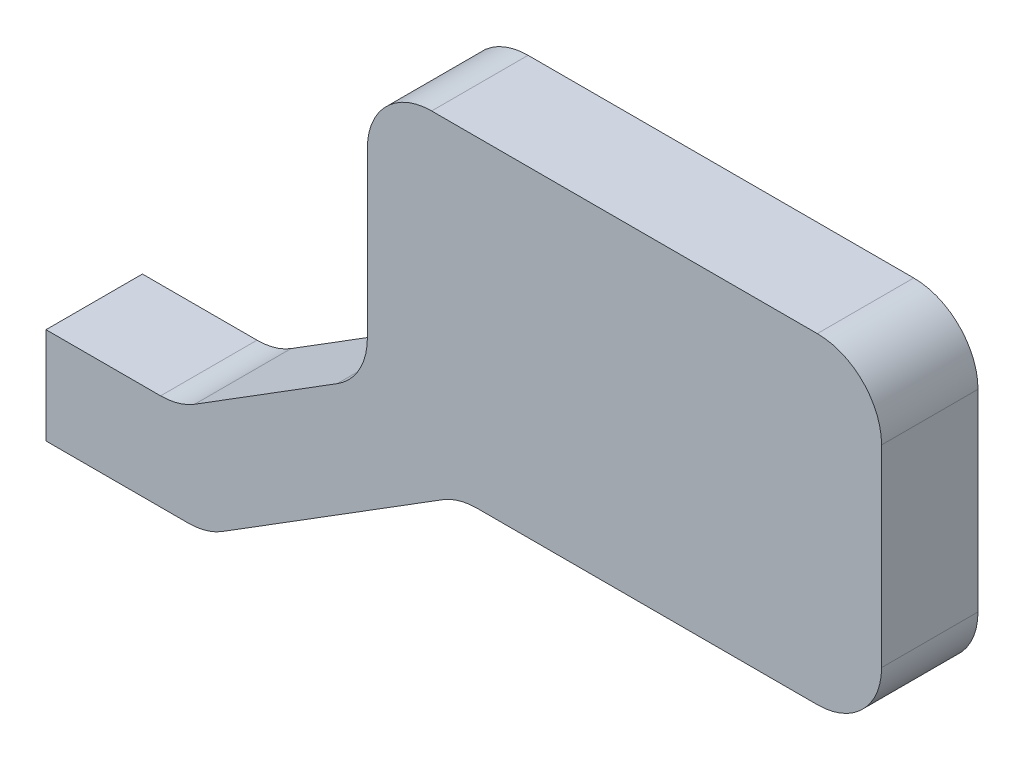
from build123d import *

# Parameters (mm, degrees)
SKETCH_1_W      = 16
SKETCH_1_H      = 10
EXTRUDE_1_DEPTH = 3
FILLET_1_R      = 2


with BuildPart() as part:
    # 草图1 → 凸台-拉伸1 (new body)
    with BuildSketch(Plane.XY):
        Polygon((-8, -5), (-8, -3.231128538), (-13.860388679, -6.893871462), (-18, -6.893871462), (-18, -9.893871462), (-13, -9.893871462), (-5.16980566, -5), align=None)
        Rectangle(SKETCH_1_W, SKETCH_1_H)
    extrude(amount=EXTRUDE_1_DEPTH)

    # 圆角1
    fillet_1_edges = [part.edges().sort_by_distance(p)[0] for p in [
        (-13, -9.893871462, 1.5),
        (-13.860388679, -6.893871462, 1.5),
        (-8, -3.231128538, 1.5),
        (-8, 5, 1.5),
        (8, 5, 1.5),
        (8, -5, 1.5),
        (-5.16980566, -5, 1.5),
    ]]
    fillet(fillet_1_edges, radius=FILLET_1_R)


solid = part.part
